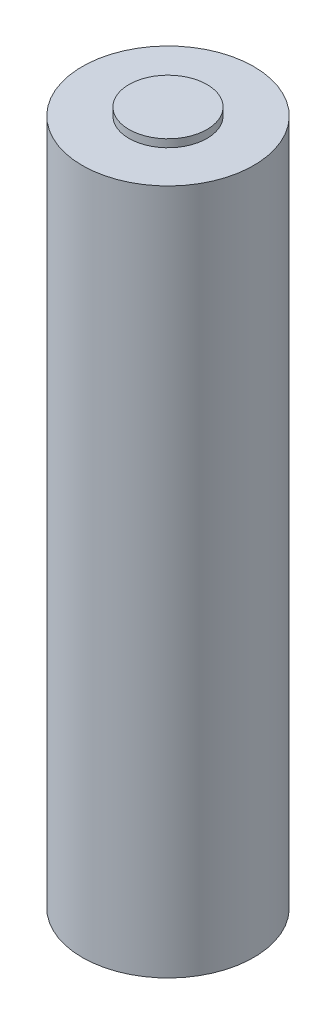
from build123d import *

# Parameters (mm, degrees)
SKETCH1_R      = 5.5
EXTRUDE1_DEPTH = 44
SKETCH2_R      = 2.5
EXTRUDE2_DEPTH = 0.5


with BuildPart() as part:
    # Sketch1 → Extrude1 (new body)
    with BuildSketch(Plane(origin=(0, 0, 0), x_dir=(1, 0, 0), z_dir=(0, 1, 0))):
        with Locations(Location((0, 0, 0), (0, 0, 270))):
            Circle(SKETCH1_R)
    extrude(amount=EXTRUDE1_DEPTH)

    # Sketch2 → Extrude2 (add)
    with BuildSketch(Plane(origin=(0, 44, 0), x_dir=(-1, 0, 0), z_dir=(0, 1, 0))):
        with Locations(Location((0, 0, 0), (0, 0, 90))):
            Circle(SKETCH2_R)
    extrude(amount=EXTRUDE2_DEPTH)


solid = part.part
